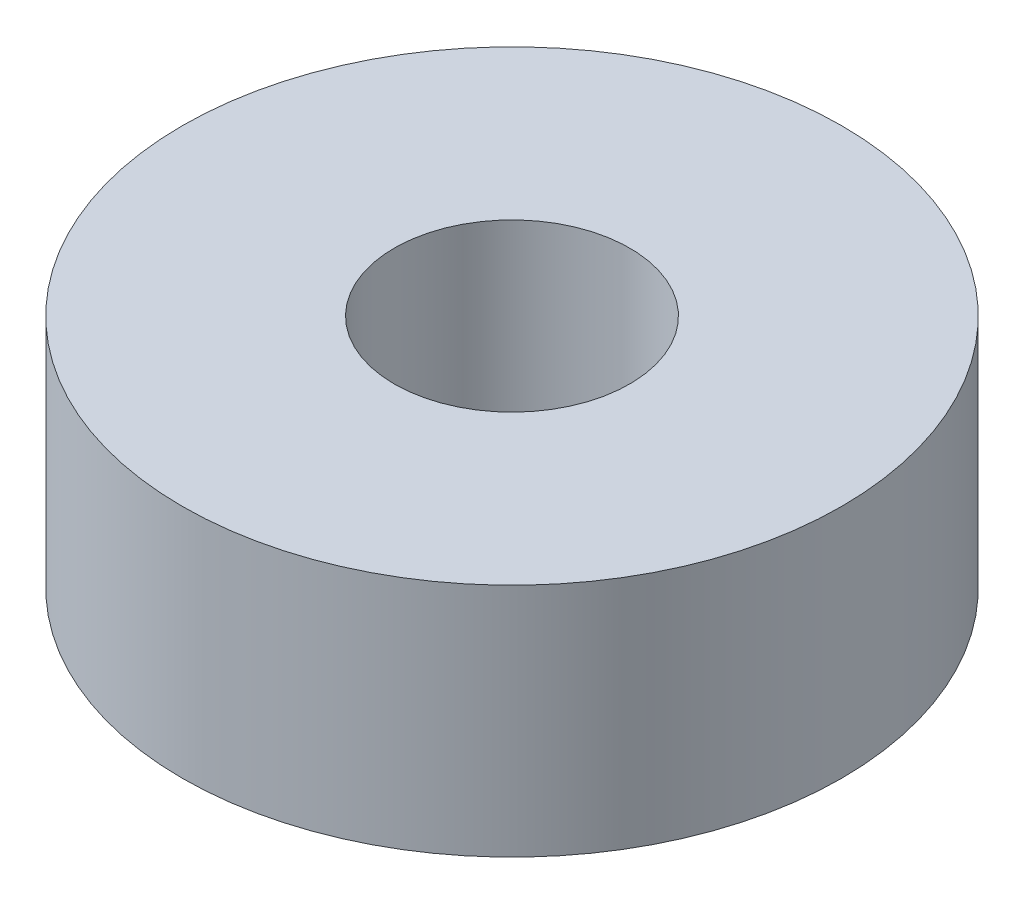
from build123d import *

# Parameters (mm, degrees)
SKETCH1_R           = 7
BOSS_EXTRUDE1_DEPTH = 2.5
CUT_EXTRUDE1_REACH  = 13.091
SKETCH2_R           = 2.5


with BuildPart() as part:
    # Sketch1 → Boss-Extrude1 (new, symmetric)
    with BuildSketch(Plane(origin=(0, 0, 0), x_dir=(1, 0, 0), z_dir=(0, 1, 0))):
        with Locations(Location((0, 0, 0), (0, 0, 270))):
            Circle(SKETCH1_R)
    extrude(amount=BOSS_EXTRUDE1_DEPTH, both=True)

    # Sketch2 → Cut-Extrude1 (cut, up to next)
    with BuildSketch(Plane(origin=(0, 2.5, 0), x_dir=(1, 0, 0), z_dir=(0, 1, 0)), mode=Mode.PRIVATE) as cut_extrude1_sk1:
        with Locations(Location((0, 0, 0), (0, 0, 270))):
            Circle(SKETCH2_R)
    cut_extrude1_tool1 = extrude(cut_extrude1_sk1.sketch, amount=-CUT_EXTRUDE1_REACH, mode=Mode.PRIVATE) & part.part
    add(cut_extrude1_tool1.solids().sort_by_distance((0, 2.5, 0))[0], mode=Mode.SUBTRACT)


solid = part.part
